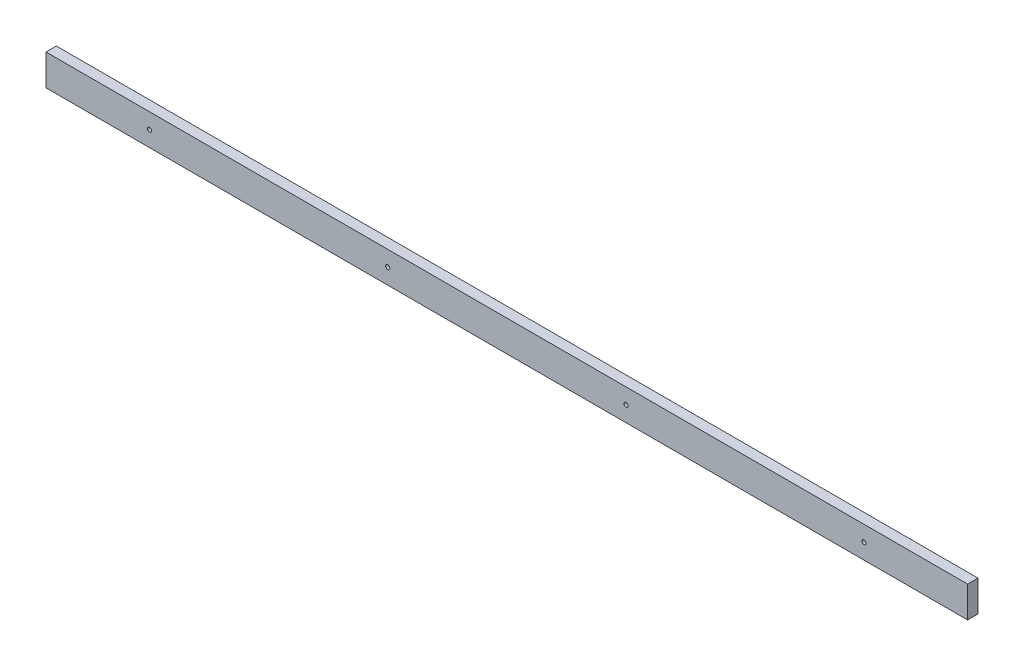
from build123d import *

# Parameters (mm, degrees)
SKETCH_1_W               = 1780
SKETCH_1_H               = 60
EXTRUDE_1_DEPTH          = 10
CUT_EXTRUDE_1_DEPTH      = 891.561620552
CUT_EXTRUDE_1_DEPTH_BACK = 891.561620552
SKETCH_2_R               = 4


with BuildPart() as part:
    # Эскиз1 → Бобышка-Вытянуть1 (new, symmetric)
    with BuildSketch(Plane.XY):
        Rectangle(SKETCH_1_W, SKETCH_1_H)
    extrude(amount=EXTRUDE_1_DEPTH, both=True)

    # Эскиз2 → Вырез-Вытянуть1 (cut, two sides: drawn at the far end of the back side and taken through both)
    with BuildSketch(Plane.XY.offset(-CUT_EXTRUDE_1_DEPTH_BACK)):
        with Locations((-690, 0)):
            Circle(SKETCH_2_R)
        with Locations((-230, 0)):
            Circle(SKETCH_2_R)
        with Locations(Location((230, 0, 0), (0, 0, 180))):
            Circle(SKETCH_2_R)
        with Locations(Location((690, 0, 0), (0, 0, 180))):
            Circle(SKETCH_2_R)
    extrude(amount=CUT_EXTRUDE_1_DEPTH + CUT_EXTRUDE_1_DEPTH_BACK, mode=Mode.SUBTRACT)


solid = part.part
